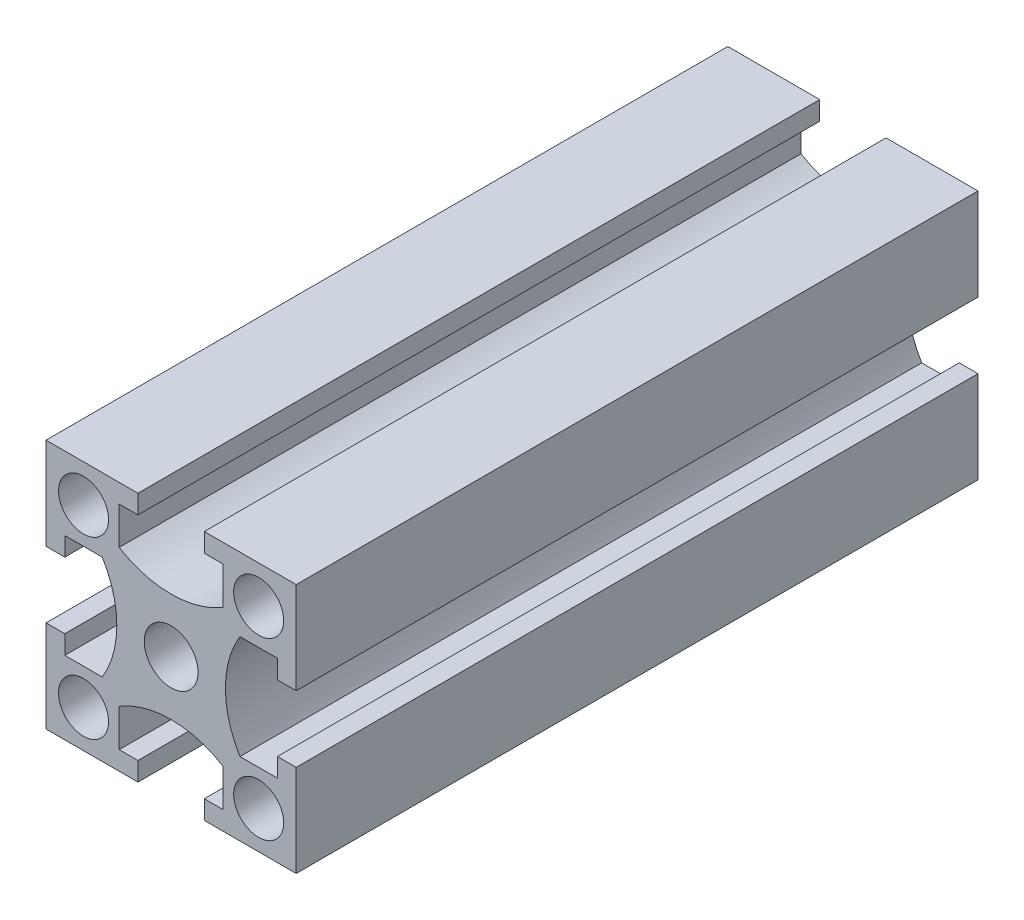
from build123d import *

# Parameters (mm, degrees)
SKETCH_1_W          = 20
SKETCH_1_H          = 20
EXTRUDE_1_DEPTH     = 54.5
SKETCH_2_R          = 2.15
SKETCH_2_R_2        = 2
CUT_EXTRUDE_1_DEPTH = 315.5


with BuildPart() as part:
    # 스케치1 → 보스-돌출1 (new body)
    with BuildSketch(Plane.XY):
        Rectangle(SKETCH_1_W, SKETCH_1_H)
    extrude(amount=EXTRUDE_1_DEPTH)

    # 스케치2 → 컷-돌출1 (cut)
    with BuildSketch(Plane.XY.offset(54.5)):
        Circle(SKETCH_2_R)
        with Locations((-7, 7)):
            Circle(SKETCH_2_R_2)
        with Locations((7, 7)):
            Circle(SKETCH_2_R_2)
        with Locations((7, -7)):
            Circle(SKETCH_2_R_2)
        with Locations((-7, -7)):
            Circle(SKETCH_2_R_2)
        with BuildLine():
            Line((-2.65, 10), (-2.65, 8.5))
            Line((-2.65, 8.5), (-4.15, 8.5))
            Line((-4.15, 8.5), (-4.15, 5.5))
            ThreePointArc((-4.15, 5.5), (0, 4.339407869), (4.15, 5.5))
            Line((4.15, 5.5), (4.15, 8.5))
            Line((4.15, 8.5), (2.65, 8.5))
            Line((2.65, 8.5), (2.65, 10))
            Line((2.65, 10), (-2.65, 10))
        make_face()
        with BuildLine():
            Line((10, 2.65), (8.5, 2.65))
            Line((8.5, 2.65), (8.5, 4.15))
            Line((8.5, 4.15), (5.5, 4.15))
            ThreePointArc((5.5, 4.15), (4.339407869, 0), (5.5, -4.15))
            Line((5.5, -4.15), (8.5, -4.15))
            Line((8.5, -4.15), (8.5, -2.65))
            Line((8.5, -2.65), (10, -2.65))
            Line((10, -2.65), (10, 2.65))
        make_face()
        with BuildLine():
            Line((2.65, -10), (2.65, -8.5))
            Line((2.65, -8.5), (4.15, -8.5))
            Line((4.15, -8.5), (4.15, -5.5))
            ThreePointArc((4.15, -5.5), (0, -4.339407869), (-4.15, -5.5))
            Line((-4.15, -5.5), (-4.15, -8.5))
            Line((-4.15, -8.5), (-2.65, -8.5))
            Line((-2.65, -8.5), (-2.65, -10))
            Line((-2.65, -10), (2.65, -10))
        make_face()
        with BuildLine():
            Line((-10, -2.65), (-8.5, -2.65))
            Line((-8.5, -2.65), (-8.5, -4.15))
            Line((-8.5, -4.15), (-5.5, -4.15))
            ThreePointArc((-5.5, -4.15), (-4.339407869, 0), (-5.5, 4.15))
            Line((-5.5, 4.15), (-8.5, 4.15))
            Line((-8.5, 4.15), (-8.5, 2.65))
            Line((-8.5, 2.65), (-10, 2.65))
            Line((-10, 2.65), (-10, -2.65))
        make_face()
    extrude(amount=-CUT_EXTRUDE_1_DEPTH, mode=Mode.SUBTRACT)


solid = part.part
